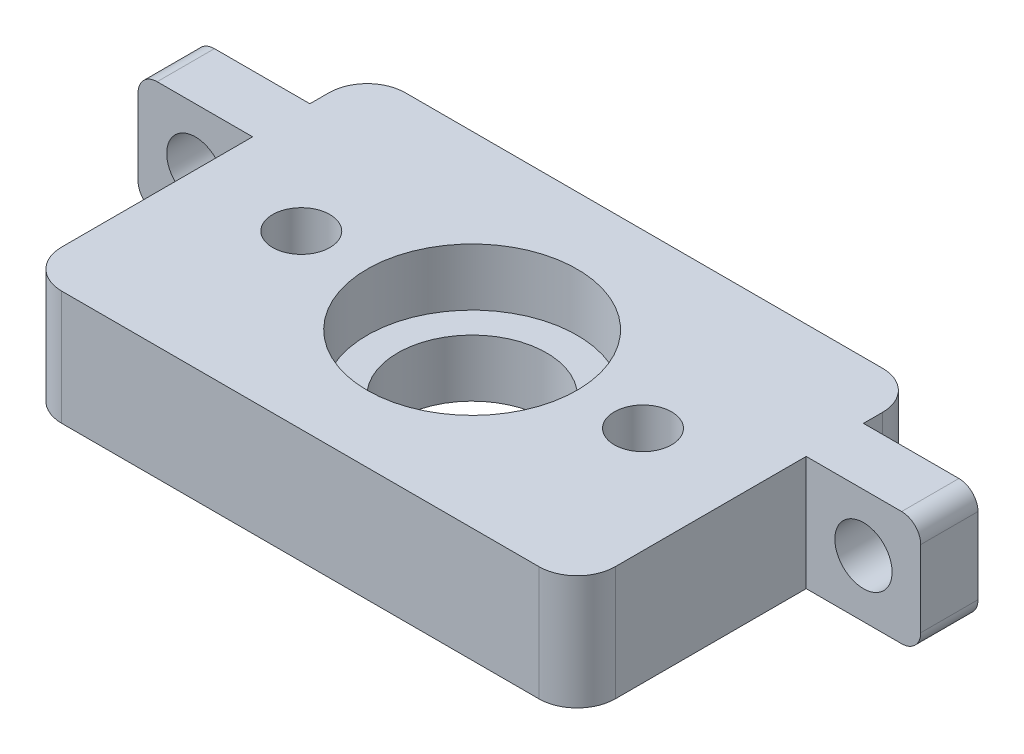
from build123d import *

# Parameters (mm, degrees)
SKETCH_1_W          = 29
SKETCH_1_H          = 18
SKETCH_1_R          = 5.5
SKETCH_1_R_2        = 1.5
EXTRUDE_1_DEPTH     = 6
SKETCH_1_6_R        = 5.5
SKETCH_1_6_R_2      = 3.9
EXTRUDE_2_DEPTH     = 3
SKETCH_2_W          = 3
SKETCH_2_H          = 6
EXTRUDE_3_DEPTH     = 6
SKETCH_4_R          = 1.5
CUT_EXTRUDE_1_DEPTH = 6
SKETCH_5_W          = 3
SKETCH_5_H          = 6
EXTRUDE_4_DEPTH     = 6
SKETCH_7_R          = 1.5
CUT_EXTRUDE_2_DEPTH = 6
FILLET_1_R          = 2
FILLET_3_R          = 1


with BuildPart() as part:
    # 草图1 → 凸台-拉伸1 (new body)
    with BuildSketch(Plane(origin=(0, 0, 0), x_dir=(1, 0, 0), z_dir=(0, 1, 0))):
        with Locations((15.4, 42.3)):
            Rectangle(SKETCH_1_W, SKETCH_1_H)
        with Locations((15.4, 42.3)):
            Circle(SKETCH_1_R, mode=Mode.SUBTRACT)
        with Locations((24.35, 42.3)):
            Circle(SKETCH_1_R_2, mode=Mode.SUBTRACT)
        with Locations((6.45, 42.3)):
            Circle(SKETCH_1_R_2, mode=Mode.SUBTRACT)
    extrude(amount=EXTRUDE_1_DEPTH)

    # 草图1<6> → 凸台-拉伸2 (add)
    with BuildSketch(Plane(origin=(0, 0, 0), x_dir=(1, 0, 0), z_dir=(0, 1, 0))):
        with Locations((15.4, 42.3)):
            Circle(SKETCH_1_6_R)
        with Locations((15.4, 42.3)):
            Circle(SKETCH_1_6_R_2, mode=Mode.SUBTRACT)
    extrude(amount=EXTRUDE_2_DEPTH)

    # 草图2 → 凸台-拉伸3 (add)
    with BuildSketch(Plane.ZY.offset(-0.9)):
        with Locations((-46.8, 3)):
            Rectangle(SKETCH_2_W, SKETCH_2_H)
    extrude(amount=EXTRUDE_3_DEPTH)

    # 草图4 → 切除-拉伸1 (cut)
    with BuildSketch(Plane.XY.offset(-45.3)):
        with Locations((-2.1, 3)):
            Circle(SKETCH_4_R)
    extrude(amount=-CUT_EXTRUDE_1_DEPTH, mode=Mode.SUBTRACT)

    # 草图5 → 凸台-拉伸4 (add)
    with BuildSketch(Plane(origin=(29.9, 0, 0), x_dir=(0, 0, -1), z_dir=(1, 0, 0))):
        with Locations((46.8, 3)):
            Rectangle(SKETCH_5_W, SKETCH_5_H)
    extrude(amount=EXTRUDE_4_DEPTH)

    # 草图7 → 切除-拉伸2 (cut)
    with BuildSketch(Plane(origin=(0, 0, -48.3), x_dir=(-1, 0, 0), z_dir=(0, 0, -1))):
        with Locations((-32.9, 3)):
            Circle(SKETCH_7_R)
    extrude(amount=-CUT_EXTRUDE_2_DEPTH, mode=Mode.SUBTRACT)

    # 圆角1
    fillet_1_edges = [part.edges().sort_by_distance(p)[0] for p in [
        (29.9, 3, -33.3),
        (0.9, 3, -33.3),
        (0.9, 3, -51.3),
        (29.9, 3, -51.3),
    ]]
    fillet(fillet_1_edges, radius=FILLET_1_R)

    # 圆角3
    fillet_3_edges = [part.edges().sort_by_distance(p)[0] for p in [
        (35.9, 6, -46.8),
        (35.9, 0, -46.8),
        (-5.1, 0, -46.8),
        (-5.1, 6, -46.8),
    ]]
    fillet(fillet_3_edges, radius=FILLET_3_R)


solid = part.part
